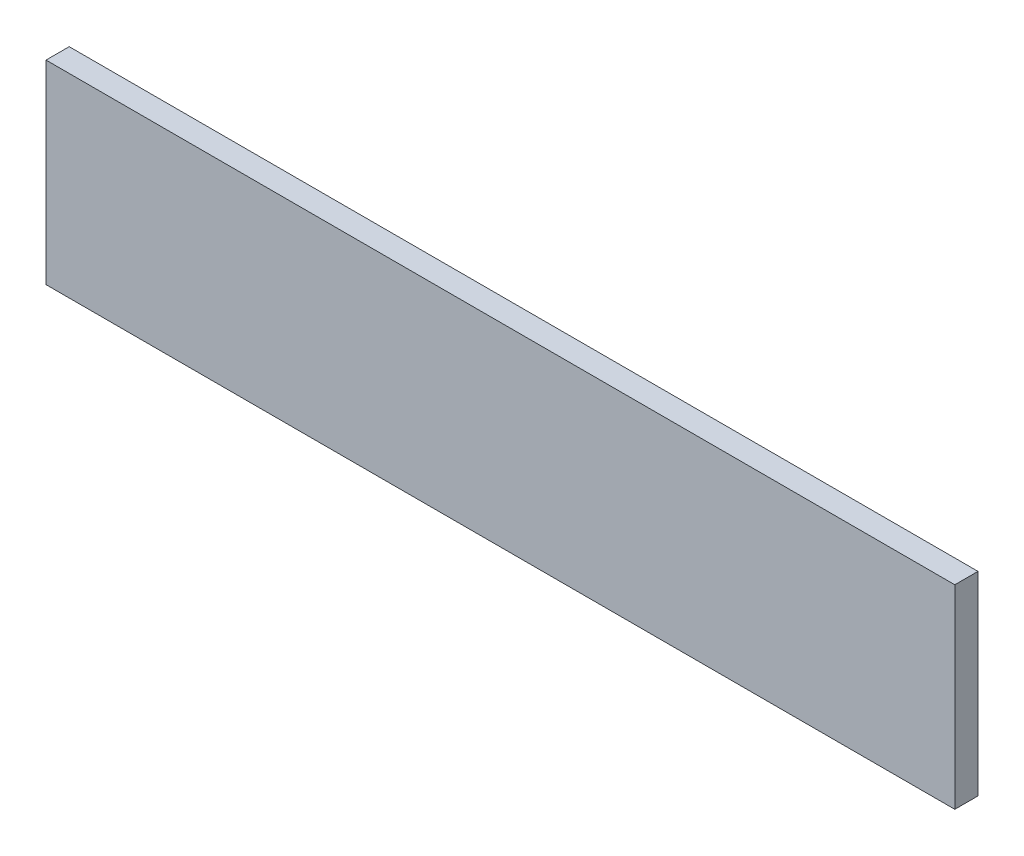
from build123d import *

# Parameters (mm, degrees)
SCHIZZO1_W                   = 2000
SCHIZZO1_H                   = 400
ESTRUSIONE_ESTRUSIONE1_DEPTH = 40
SCHIZZO2_W                   = 2037.257507086
SCHIZZO2_H                   = 435.989192526
ESTRUSIONE_ESTRUSIONE2_DEPTH = 52


with BuildPart() as part:
    # Schizzo1 → Estrusione-Estrusione1 (new body)
    with BuildSketch(Plane.XY):
        Rectangle(SCHIZZO1_W, SCHIZZO1_H)
    extrude(amount=ESTRUSIONE_ESTRUSIONE1_DEPTH)


with BuildPart() as body_2:
    # Schizzo2 → Estrusione-Estrusione2 (new body)
    with BuildSketch(Plane(origin=(0, 0, 0), x_dir=(-1, 0, 0), z_dir=(0, 0, -1))):
        Rectangle(SCHIZZO2_W, SCHIZZO2_H)
    extrude(amount=-ESTRUSIONE_ESTRUSIONE2_DEPTH)


solid = Compound([part.part, body_2.part])
